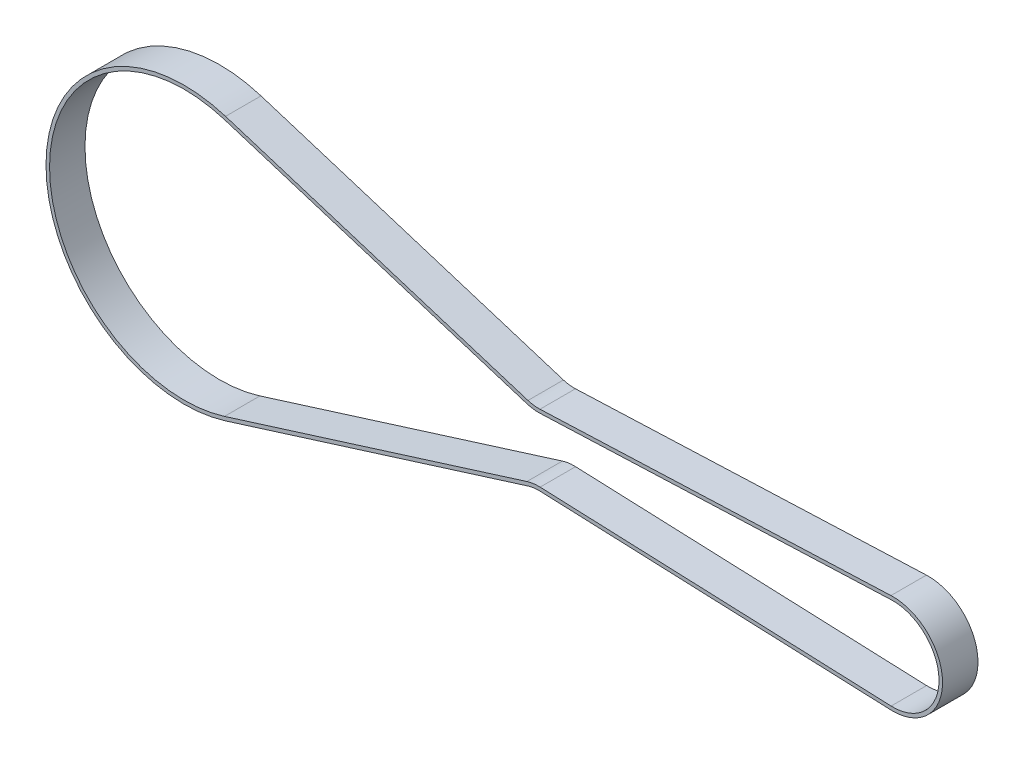
from build123d import *

# Parameters (mm, degrees)
EXTRU_MINCE1_DEPTH = 10


with BuildPart() as part:
    # Esquisse1 → Extru.-Mince1 (new body)
    with BuildSketch(Plane.XY):
        with BuildLine():
            Line((-118.630702561, -32.176352928), (-203.97189354, -58.932307822))
            ThreePointArc((-203.97189354, -58.932307822), (-254.639108883, -21.718384539), (-203.97189354, 15.495538744))
            Line((-203.97189354, 15.495538744), (-118.630702561, -11.26041615))
            ThreePointArc((-118.630702561, -11.26041615), (-116.953491562, -11.631628114), (-115.237495298, -11.710316611))
            Line((-115.237495298, -11.710316611), (-16.201367903, -7.729679639))
            ThreePointArc((-16.201367903, -7.729679639), (-1.639108883, -21.718384539), (-16.201367903, -35.70708944))
            Line((-16.201367903, -35.70708944), (-115.237495298, -31.726452467))
            ThreePointArc((-115.237495298, -31.726452467), (-116.953491562, -31.805140964), (-118.630702561, -32.176352928))
        make_face()
        with BuildLine():
            Line((-118.929861929, -31.222149767), (-204.271052908, -57.978104661))
            ThreePointArc((-204.271052908, -57.978104661), (-253.639108883, -21.718384539), (-204.271052908, 14.541335583))
            Line((-204.271052908, 14.541335583), (-118.929861929, -12.214619311))
            ThreePointArc((-118.929861929, -12.214619311), (-117.08492983, -12.622952471), (-115.197333939, -12.709509818))
            Line((-115.197333939, -12.709509818), (-16.161206545, -8.728872846))
            ThreePointArc((-16.161206545, -8.728872846), (-2.639108883, -21.718384539), (-16.161206545, -34.707896233))
            Line((-16.161206545, -34.707896233), (-115.197333939, -30.72725926))
            ThreePointArc((-115.197333939, -30.72725926), (-117.08492983, -30.813816607), (-118.929861929, -31.222149767))
        make_face(mode=Mode.SUBTRACT)
    extrude(amount=EXTRU_MINCE1_DEPTH)


solid = part.part
